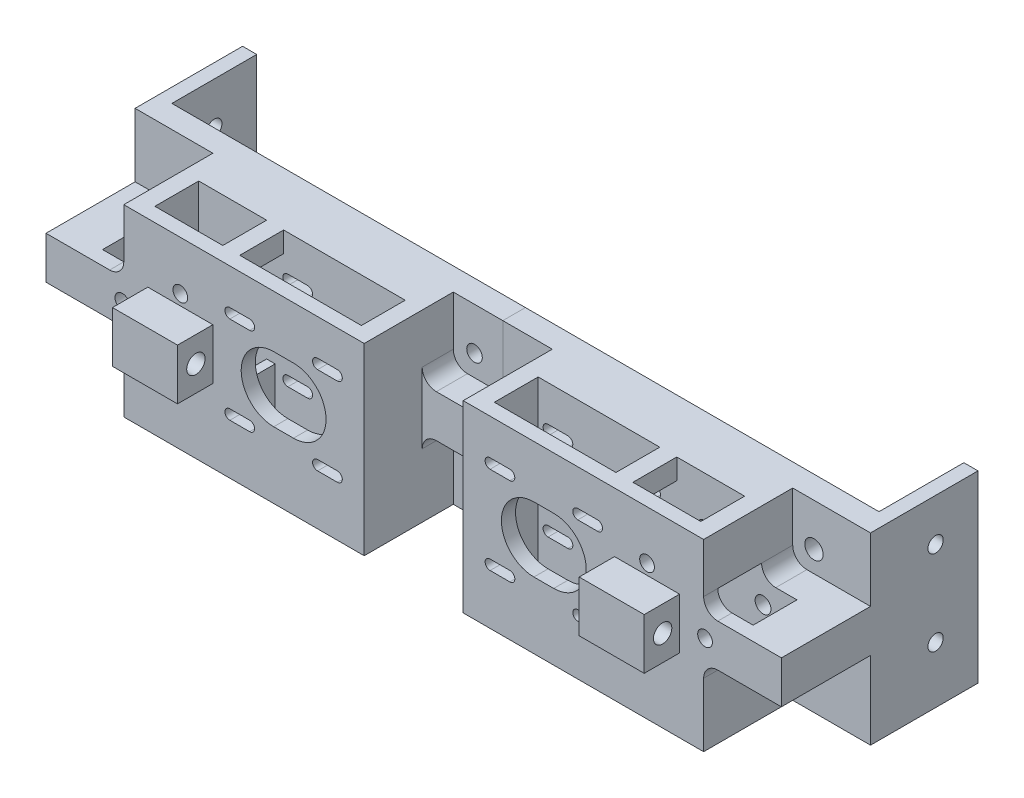
from build123d import *

# Parameters (mm, degrees)
SKETCH1_W           = 125
SKETCH1_H           = 60
SKETCH1_R           = 2.8
SKETCH1_R_2         = 3.25
SKETCH1_R_3         = 2.75
BOSS_EXTRUDE1_DEPTH = 19
CUT_EXTRUDE1_DEPTH  = 11
SKETCH3_R           = 3.25
CUT_EXTRUDE2_DEPTH  = 8
BOSS_EXTRUDE2_DEPTH = 5
BOSS_EXTRUDE3_REACH = 142.162
SKETCH5_W           = 6
SKETCH5_H           = 60
SKETCH5_H_2         = 17.5
SKETCH5_H_3         = 7.275
SKETCH5_W_2         = 3
SKETCH5_W_3         = 10
SKETCH5_H_4         = 15
CUT_EXTRUDE3_DEPTH  = 145.170905525
SKETCH7_W           = 23
SKETCH7_H           = 18
BOSS_EXTRUDE4_DEPTH = 12.5
SKETCH8_R           = 3.25
CUT_EXTRUDE4_DEPTH  = 124.044707322
SKETCH9_R           = 2.7
SKETCH9_W           = 24
SKETCH9_H           = 15.5
SKETCH9_W_2         = 46
BOSS_EXTRUDE5_DEPTH = 5
SKETCH10_R          = 2.7
BOSS_EXTRUDE6_DEPTH = 5
SKETCH11_R          = 2.6
CUT_EXTRUDE5_DEPTH  = 153.922365925


with BuildPart() as part:
    # Sketch1 → Boss-Extrude1 (new body)
    with BuildSketch(Plane.XY):
        with Locations((-62.5, 30)):
            Rectangle(SKETCH1_W, SKETCH1_H)
        with Locations((-42.5, 42.725)):
            Circle(SKETCH1_R, mode=Mode.SUBTRACT)
        with Locations((-22, 30)):
            Circle(SKETCH1_R, mode=Mode.SUBTRACT)
        with Locations((-15, 45)):
            Circle(SKETCH1_R_2, mode=Mode.SUBTRACT)
        with Locations((-15, 15)):
            Circle(SKETCH1_R_2, mode=Mode.SUBTRACT)
        with Locations((-115, 15)):
            Circle(SKETCH1_R_3, mode=Mode.SUBTRACT)
        with Locations((-115, 45)):
            Circle(SKETCH1_R_3, mode=Mode.SUBTRACT)
    extrude(amount=BOSS_EXTRUDE1_DEPTH)

    # Sketch2 → Cut-Extrude1 (cut)
    with BuildSketch(Plane.XY.offset(19)):
        with BuildLine():
            Line((0, 0), (-22.5, 0))
            Line((-22.5, 0), (-22.5, 17.5))
            ThreePointArc((-22.5, 17.5), (-21.035533906, 21.035533906), (-17.5, 22.5))
            Line((-17.5, 22.5), (0, 22.5))
            Line((0, 22.5), (0, 0))
        make_face()
        with BuildLine():
            Line((0, 60), (-22.5, 60))
            Line((-22.5, 60), (-22.5, 42.5))
            ThreePointArc((-22.5, 42.5), (-21.035533906, 38.964466094), (-17.5, 37.5))
            Line((-17.5, 37.5), (0, 37.5))
            Line((0, 37.5), (0, 60))
        make_face()
        with BuildLine():
            Line((-107.5, 60), (-107.5, 42.5))
            ThreePointArc((-107.5, 42.5), (-108.964466094, 38.964466094), (-112.5, 37.5))
            Line((-112.5, 37.5), (-125, 37.5))
            Line((-125, 37.5), (-125, 60))
            Line((-125, 60), (-107.5, 60))
        make_face()
        with BuildLine():
            Line((-125, 0), (-107.5, 0))
            Line((-107.5, 0), (-107.5, 17.5))
            ThreePointArc((-107.5, 17.5), (-108.964466094, 21.035533906), (-112.5, 22.5))
            Line((-112.5, 22.5), (-125, 22.5))
            Line((-125, 22.5), (-125, 0))
        make_face()
    extrude(amount=-CUT_EXTRUDE1_DEPTH, mode=Mode.SUBTRACT)

    # Sketch3 → Cut-Extrude2 (cut)
    with BuildSketch(Plane(origin=(0, 0, 0), x_dir=(-1, 0, 0), z_dir=(0, 0, -1))):
        with Locations((22, 30)):
            Circle(SKETCH3_R)
        with Locations((42.5, 42.725)):
            Circle(SKETCH3_R)
    extrude(amount=-CUT_EXTRUDE2_DEPTH, mode=Mode.SUBTRACT)


with BuildPart() as body_2:
    # Sketch4 → Boss-Extrude2 (new body)
    with BuildSketch(Plane.XY.offset(34.5)):
        with BuildLine():
            Line((-107.5, 60), (-107.5, 0))
            Line((-107.5, 0), (-22.5, 0))
            Line((-22.5, 0), (-22.5, 17.5))
            ThreePointArc((-22.5, 17.5), (-21.035533906, 21.035533906), (-17.5, 22.5))
            Line((-17.5, 22.5), (0, 22.5))
            Line((0, 22.5), (0, 37.5))
            Line((0, 37.5), (-17.5, 37.5))
            ThreePointArc((-17.5, 37.5), (-21.035533906, 38.964466094), (-22.5, 42.5))
            Line((-22.5, 42.5), (-22.5, 60))
            Line((-22.5, 60), (-107.5, 60))
        make_face()
    extrude(amount=BOSS_EXTRUDE2_DEPTH)

    # Sketch5 → Boss-Extrude3 (add, up to next)
    with BuildSketch(Plane.XY.offset(19), mode=Mode.PRIVATE) as boss_extrude3_sk1:
        with Locations((-104.5, 30)):
            Rectangle(SKETCH5_W, SKETCH5_H)
    boss_extrude3_tool1 = extrude(boss_extrude3_sk1.sketch, amount=BOSS_EXTRUDE3_REACH, mode=Mode.PRIVATE) - body_2.part
    # Sketch5 → Boss-Extrude3 (add, up to next)
    with BuildSketch(Plane.XY.offset(19), mode=Mode.PRIVATE) as boss_extrude3_sk2:
        with Locations((-25.5, 8.75)):
            Rectangle(SKETCH5_W, SKETCH5_H_2)
    boss_extrude3_tool2 = extrude(boss_extrude3_sk2.sketch, amount=BOSS_EXTRUDE3_REACH, mode=Mode.PRIVATE) - body_2.part
    # Sketch5 → Boss-Extrude3 (add, up to next)
    with BuildSketch(Plane.XY.offset(19), mode=Mode.PRIVATE) as boss_extrude3_sk3:
        with Locations((-25.5, 51.25)):
            Rectangle(SKETCH5_W, SKETCH5_H_2)
    boss_extrude3_tool3 = extrude(boss_extrude3_sk3.sketch, amount=BOSS_EXTRUDE3_REACH, mode=Mode.PRIVATE) - body_2.part
    # Sketch5 → Boss-Extrude3 (add, up to next)
    with BuildSketch(Plane.XY.offset(19), mode=Mode.PRIVATE) as boss_extrude3_sk4:
        with Locations((-55.5, 56.3625)):
            Rectangle(SKETCH5_W, SKETCH5_H_3)
    boss_extrude3_tool4 = extrude(boss_extrude3_sk4.sketch, amount=BOSS_EXTRUDE3_REACH, mode=Mode.PRIVATE) - body_2.part
    # Sketch5 → Boss-Extrude3 (add, up to next)
    with BuildSketch(Plane.XY.offset(19), mode=Mode.PRIVATE) as boss_extrude3_sk5:
        with Locations((-54, 8.75)):
            Rectangle(SKETCH5_W_2, SKETCH5_H_2)
    boss_extrude3_tool5 = extrude(boss_extrude3_sk5.sketch, amount=BOSS_EXTRUDE3_REACH, mode=Mode.PRIVATE) - body_2.part
    # Sketch5 → Boss-Extrude3 (add, up to next)
    with BuildSketch(Plane.XY.offset(19), mode=Mode.PRIVATE) as boss_extrude3_sk6:
        with Locations((-5, 30)):
            Rectangle(SKETCH5_W_3, SKETCH5_H_4)
    boss_extrude3_tool6 = extrude(boss_extrude3_sk6.sketch, amount=BOSS_EXTRUDE3_REACH, mode=Mode.PRIVATE) - body_2.part

    add(part.part)  # Boss-Extrude3 merges part
    add(boss_extrude3_tool1.solids().sort_by_distance((-104.5, 30, 19))[0])
    add(boss_extrude3_tool2.solids().sort_by_distance((-25.5, 8.75, 19))[0])
    add(boss_extrude3_tool3.solids().sort_by_distance((-25.5, 51.25, 19))[0])
    add(boss_extrude3_tool4.solids().sort_by_distance((-55.5, 56.3625, 19))[0])
    add(boss_extrude3_tool5.solids().sort_by_distance((-54, 8.75, 19))[0])
    add(boss_extrude3_tool6.solids().sort_by_distance((-5, 30, 19))[0])

    # Sketch6 → Cut-Extrude3 (cut, through all)
    with BuildSketch(Plane.XY.offset(39.5)):
        with BuildLine():
            Line((-82.5, 41.5), (-75.5, 41.5))
            ThreePointArc((-75.5, 41.5), (-64, 30), (-75.5, 18.5))
            Line((-75.5, 18.5), (-82.5, 18.5))
            ThreePointArc((-82.5, 18.5), (-94, 30), (-82.5, 41.5))
        make_face()
        with BuildLine():
            Line((-91, 43.75), (-98, 43.75))
            ThreePointArc((-98, 43.75), (-99.75, 45.5), (-98, 47.25))
            Line((-98, 47.25), (-91, 47.25))
            ThreePointArc((-91, 47.25), (-89.25, 45.5), (-91, 43.75))
        make_face()
        with BuildLine():
            Line((-67, 47.25), (-60, 47.25))
            ThreePointArc((-60, 47.25), (-58.25, 45.5), (-60, 43.75))
            Line((-60, 43.75), (-67, 43.75))
            ThreePointArc((-67, 43.75), (-68.75, 45.5), (-67, 47.25))
        make_face()
        with BuildLine():
            Line((-91, 12.75), (-98, 12.75))
            ThreePointArc((-98, 12.75), (-99.75, 14.5), (-98, 16.25))
            Line((-98, 16.25), (-91, 16.25))
            ThreePointArc((-91, 16.25), (-89.25, 14.5), (-91, 12.75))
        make_face()
        with BuildLine():
            Line((-67, 16.25), (-60, 16.25))
            ThreePointArc((-60, 16.25), (-58.25, 14.5), (-60, 12.75))
            Line((-60, 12.75), (-67, 12.75))
            ThreePointArc((-67, 12.75), (-68.75, 14.5), (-67, 16.25))
        make_face()
    extrude(amount=-CUT_EXTRUDE3_DEPTH, mode=Mode.SUBTRACT)

    # Sketch7 → Boss-Extrude4 (add)
    with BuildSketch(Plane.XY.offset(39.5)):
        with Locations((-42.5, 30)):
            Rectangle(SKETCH7_W, SKETCH7_H)
    extrude(amount=BOSS_EXTRUDE4_DEPTH)

    # Sketch8 → Cut-Extrude4 (cut, through all)
    with BuildSketch(Plane(origin=(-31, 0, 0), x_dir=(0, 0, -1), z_dir=(1, 0, 0))):
        with Locations((-45.5, 30)):
            Circle(SKETCH8_R)
    extrude(amount=-CUT_EXTRUDE4_DEPTH, mode=Mode.SUBTRACT)

    # Sketch9 → Boss-Extrude5 (add)
    with BuildSketch(Plane.XZ):
        Polygon((-125, 8), (-107.5, 8), (-107.5, 39.5), (-22.5, 39.5), (-22.5, 8), (0, 8), (0, -30), (-125, -30), align=None)
        with Locations((-110, -15)):
            Circle(SKETCH9_R, mode=Mode.SUBTRACT)
        with Locations((-80, -15)):
            Circle(SKETCH9_R, mode=Mode.SUBTRACT)
        with Locations((-45, -15)):
            Circle(SKETCH9_R, mode=Mode.SUBTRACT)
        with Locations((-15, -15)):
            Circle(SKETCH9_R, mode=Mode.SUBTRACT)
        with Locations((-40.5, 26.75)):
            Rectangle(SKETCH9_W, SKETCH9_H, mode=Mode.SUBTRACT)
        with Locations((-78.5, 26.75)):
            Rectangle(SKETCH9_W_2, SKETCH9_H, mode=Mode.SUBTRACT)
    extrude(amount=BOSS_EXTRUDE5_DEPTH)

    # Sketch10 → Boss-Extrude6 (add)
    with BuildSketch(Plane(origin=(0, 0, 0), x_dir=(0, 0, -1), z_dir=(1, 0, 0))):
        Polygon((-39.5, 37.5), (-39.5, 22.5), (-8, 22.5), (-8, -5), (30, -5), (30, 60), (-8, 60), (-8, 37.5), align=None)
        with Locations((15, 45)):
            Circle(SKETCH10_R, mode=Mode.SUBTRACT)
        with Locations((15, 15)):
            Circle(SKETCH10_R, mode=Mode.SUBTRACT)
    extrude(amount=BOSS_EXTRUDE6_DEPTH)

    # Sketch11 → Cut-Extrude5 (cut, through all)
    with BuildSketch(Plane(origin=(0, 0, 34.5), x_dir=(-1, 0, 0), z_dir=(0, 0, -1))):
        with Locations((42.5, 42.725)):
            Circle(SKETCH11_R)
        with Locations((22, 30)):
            Circle(SKETCH11_R)
    extrude(amount=-CUT_EXTRUDE5_DEPTH, mode=Mode.SUBTRACT)


with BuildPart() as body_2_2:
    # Mirror1: mirrored copy
    add(body_2.part.mirror(Plane(origin=(-125, 0, 19), x_dir=(0, 0, 1), z_dir=(1, 0, 0))))


solid = Compound([body_2.part, body_2_2.part])
